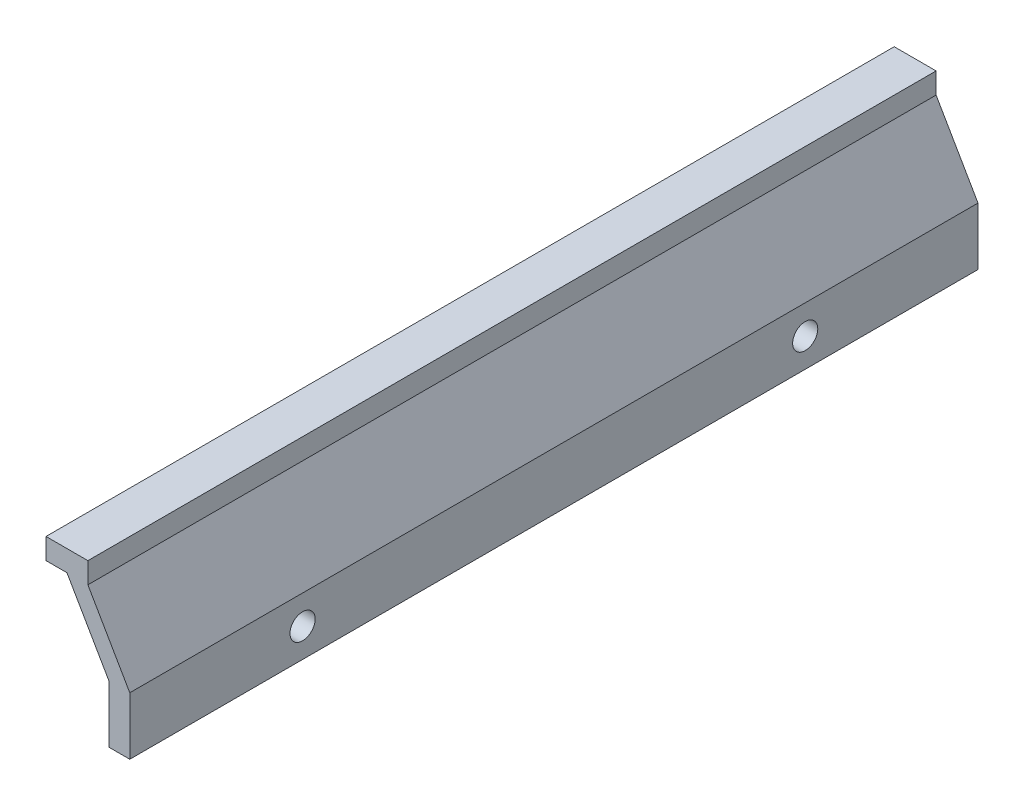
from build123d import *

# Parameters (mm, degrees)
EXTRUDE_1_DEPTH      = 76
EXTRUDE_1_DEPTH_BACK = 5
SKETCH_2_R           = 1.2
CUT_EXTRUDE_1_DEPTH  = 78.307052917


with BuildPart() as part:
    # ｽｹｯﾁ1 → ﾎﾞｽ - 押し出し1 (new, two sides: drawn at the far end of the back side and taken through both)
    with BuildSketch(Plane.XY.offset(-EXTRUDE_1_DEPTH_BACK)):
        Polygon((-5, 9.67820323), (-1, 2.75), (-1, -2.75), (1, -2.75), (1, 2.75), (-3, 9.67820323), (-3, 11.67820323), (-5, 11.67820323), (-7, 11.67820323), (-7, 9.67820323), align=None)
    extrude(amount=EXTRUDE_1_DEPTH + EXTRUDE_1_DEPTH_BACK)

    # ｽｹｯﾁ2 → ｶｯﾄ - 押し出し1 (cut, through all)
    with BuildSketch(Plane(origin=(1, 0, 0), x_dir=(0, 0, -1), z_dir=(1, 0, 0))):
        with Locations((-59.5, 0)):
            Circle(SKETCH_2_R)
        with Locations((-11.5, 0)):
            Circle(SKETCH_2_R)
    extrude(amount=-CUT_EXTRUDE_1_DEPTH, mode=Mode.SUBTRACT)


solid = part.part
